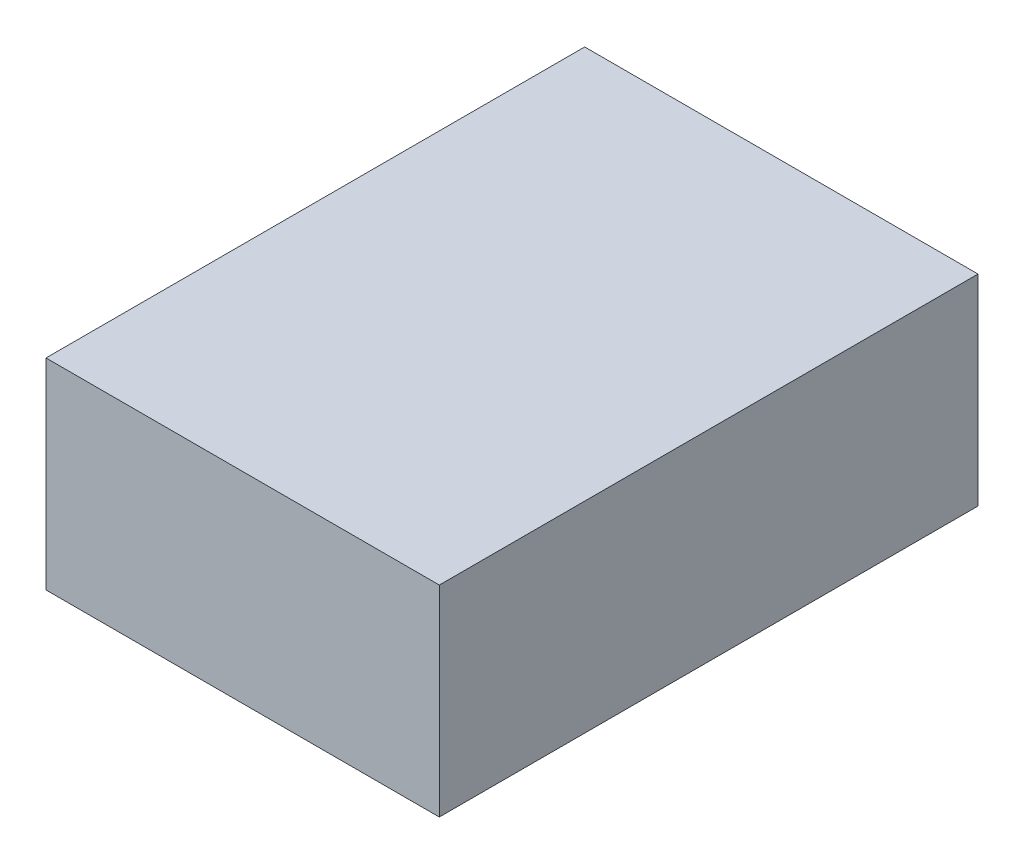
from build123d import *

# Parameters (mm, degrees)
SKETCH1_W           = 46
SKETCH1_H           = 63
BOSS_EXTRUDE1_DEPTH = 23.5


with BuildPart() as part:
    # Sketch1 → Boss-Extrude1 (new body)
    with BuildSketch(Plane(origin=(0, 0, 0), x_dir=(1, 0, 0), z_dir=(0, 1, 0))):
        Rectangle(SKETCH1_W, SKETCH1_H)
    extrude(amount=BOSS_EXTRUDE1_DEPTH)


solid = part.part
